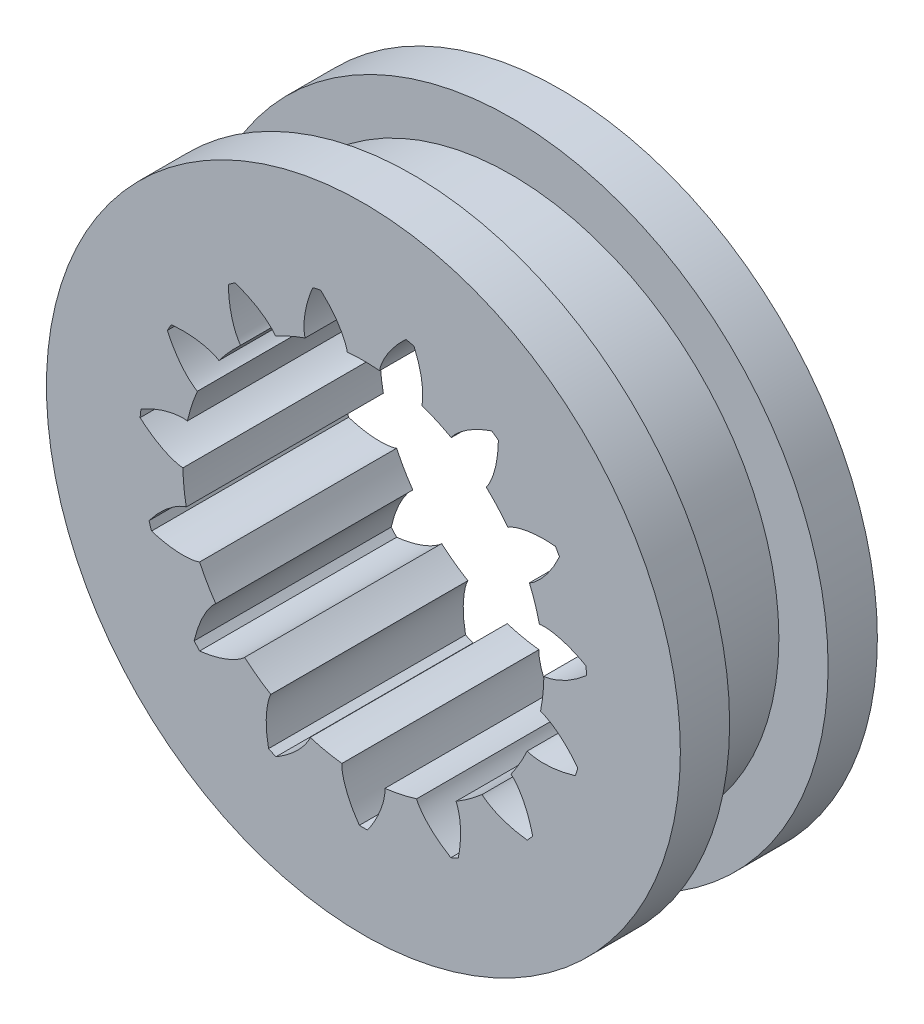
from build123d import *

# Parameters (mm, degrees)
SKETCH_1_R               = 5.43519741
SKETCH_1_R_2             = 4.55
EXTRUDE_1_DEPTH          = 4
EXTRUDE_2_DEPTH          = 4
PATTERN_CIRCULAR_1_COUNT = 15
EXTRUDE_START            = -1
SKETCH_5_R               = 6.43519741
SKETCH_5_R_2             = 5.43519741
EXTRUDE_3_DEPTH          = 1
EXTRUDE_START_2          = -4
SKETCH_5_2_R             = 6.43519741
SKETCH_5_2_R_2           = 5.43519741
EXTRUDE_4_DEPTH          = 1


with BuildPart() as part:
    # 草图1 → 凸台-拉伸1 (new body)
    with BuildSketch(Plane.XY):
        Circle(SKETCH_1_R)
        Circle(SKETCH_1_R_2, mode=Mode.SUBTRACT)
    extrude(amount=EXTRUDE_1_DEPTH)

    # 草图2 → 凸台-拉伸2 (add)
    with BuildSketch(Plane.XY):
        with BuildLine():
            ThreePointArc((0.328713246, 3.650030908), (0, 3.66480259), (-0.328713246, 3.650030908))
            add(Edge.make_bspline(
                [(-0.328713246, 3.650030908), (-0.330210228, 3.662072509), (-0.333301102, 3.677580309), (-0.338073514, 3.696979212), (-0.341308954, 3.709078441), (-0.34519128, 3.722519259), (-0.349775985, 3.73727994), (-0.355117016, 3.75333725), (-0.361267952, 3.770666271), (-0.368281577, 3.789240483), (-0.376209954, 3.809031764), (-0.385104349, 3.830010411), (-0.395015195, 3.852145161), (-0.405992051, 3.875403217), (-0.418083562, 3.899750263), (-0.431337412, 3.925150493), (-0.445800292, 3.951566637), (-0.461517856, 3.978959982), (-0.478534683, 4.0072904), (-0.496894236, 4.03651638), (-0.516638832, 4.06659505), (-0.537809598, 4.097482213), (-0.560446436, 4.129132374), (-0.584587993, 4.161498769), (-0.610271619, 4.194533405), (-0.637533339, 4.228187086), (-0.666407817, 4.262409449), (-0.696928324, 4.297149003), (-0.729126711, 4.332353157), (-0.763033371, 4.367968264), (-0.798677216, 4.403939654), (-0.836085645, 4.440211673), (-0.875284522, 4.476727723), (-0.916298132, 4.513430298), (-0.974174084, 4.563174983), (-1.019271255, 4.599614353), (-1.050183287, 4.623611363)],
                knots=[0, 0, 0, 0, 0.029439016, 0.038394893, 0.048538046, 0.059868473, 0.072386175, 0.086091151, 0.100983402, 0.117062928, 0.134329729, 0.152783805, 0.172425155, 0.193253781, 0.215269681, 0.238472855, 0.262863305, 0.288441029, 0.315206028, 0.343158302, 0.372297851, 0.402624674, 0.434138773, 0.466840146, 0.500728793, 0.535804716, 0.572067913, 0.609518385, 0.648156132, 0.687981154, 0.728993451, 0.771193022, 0.814579868, 0.859153989, 0.904915384, 1, 1, 1, 1], degree=3))
            ThreePointArc((-1.050183287, 4.623611363), (0, 4.741378173), (1.050183287, 4.623611363))
            add(Edge.make_bspline(
                [(0.328713246, 3.650030908), (0.330210228, 3.662072509), (0.333301102, 3.677580309), (0.338073514, 3.696979212), (0.341308954, 3.709078441), (0.34519128, 3.722519259), (0.349775985, 3.73727994), (0.355117016, 3.75333725), (0.361267952, 3.770666271), (0.368281577, 3.789240483), (0.376209954, 3.809031764), (0.385104349, 3.830010411), (0.395015195, 3.852145161), (0.405992051, 3.875403217), (0.418083562, 3.899750263), (0.431337412, 3.925150493), (0.445800292, 3.951566637), (0.461517856, 3.978959982), (0.478534683, 4.0072904), (0.496894236, 4.03651638), (0.516638832, 4.06659505), (0.537809598, 4.097482213), (0.560446436, 4.129132374), (0.584587993, 4.161498769), (0.610271619, 4.194533405), (0.637533339, 4.228187086), (0.666407817, 4.262409449), (0.696928324, 4.297149003), (0.729126711, 4.332353157), (0.763033371, 4.367968264), (0.798677216, 4.403939654), (0.836085645, 4.440211673), (0.875284522, 4.476727723), (0.916298132, 4.513430298), (0.974174084, 4.563174983), (1.019271255, 4.599614353), (1.050183287, 4.623611363)],
                knots=[0, 0, 0, 0, 0.029439016, 0.038394893, 0.048538046, 0.059868473, 0.072386175, 0.086091151, 0.100983402, 0.117062928, 0.134329729, 0.152783805, 0.172425155, 0.193253781, 0.215269681, 0.238472855, 0.262863305, 0.288441029, 0.315206028, 0.343158302, 0.372297851, 0.402624674, 0.434138773, 0.466840146, 0.500728793, 0.535804716, 0.572067913, 0.609518385, 0.648156132, 0.687981154, 0.728993451, 0.771193022, 0.814579868, 0.859153989, 0.904915384, 1, 1, 1, 1], degree=3))
        make_face()
    extrude_2 = extrude(amount=EXTRUDE_2_DEPTH)

    # 阵列(圆周)1: 凸台-拉伸2 ×15 about axis
    pattern_circular_1_axis = Axis((0, 0, 4), (0, 0, -1))
    for i in range(1, PATTERN_CIRCULAR_1_COUNT):
        add(extrude_2.rotate(pattern_circular_1_axis, i * 360 / PATTERN_CIRCULAR_1_COUNT))

    # 草图5 → 凸台-拉伸3 (add)
    with BuildSketch(Plane.XY.offset(4).offset(EXTRUDE_START)):
        Circle(SKETCH_5_R)
        Circle(SKETCH_5_R_2, mode=Mode.SUBTRACT)
    extrude(amount=EXTRUDE_3_DEPTH)

    # 草图5<2> → 凸台-拉伸4 (add)
    with BuildSketch(Plane.XY.offset(4).offset(EXTRUDE_START_2)):
        Circle(SKETCH_5_2_R)
        Circle(SKETCH_5_2_R_2, mode=Mode.SUBTRACT)
    extrude(amount=EXTRUDE_4_DEPTH)


solid = part.part
